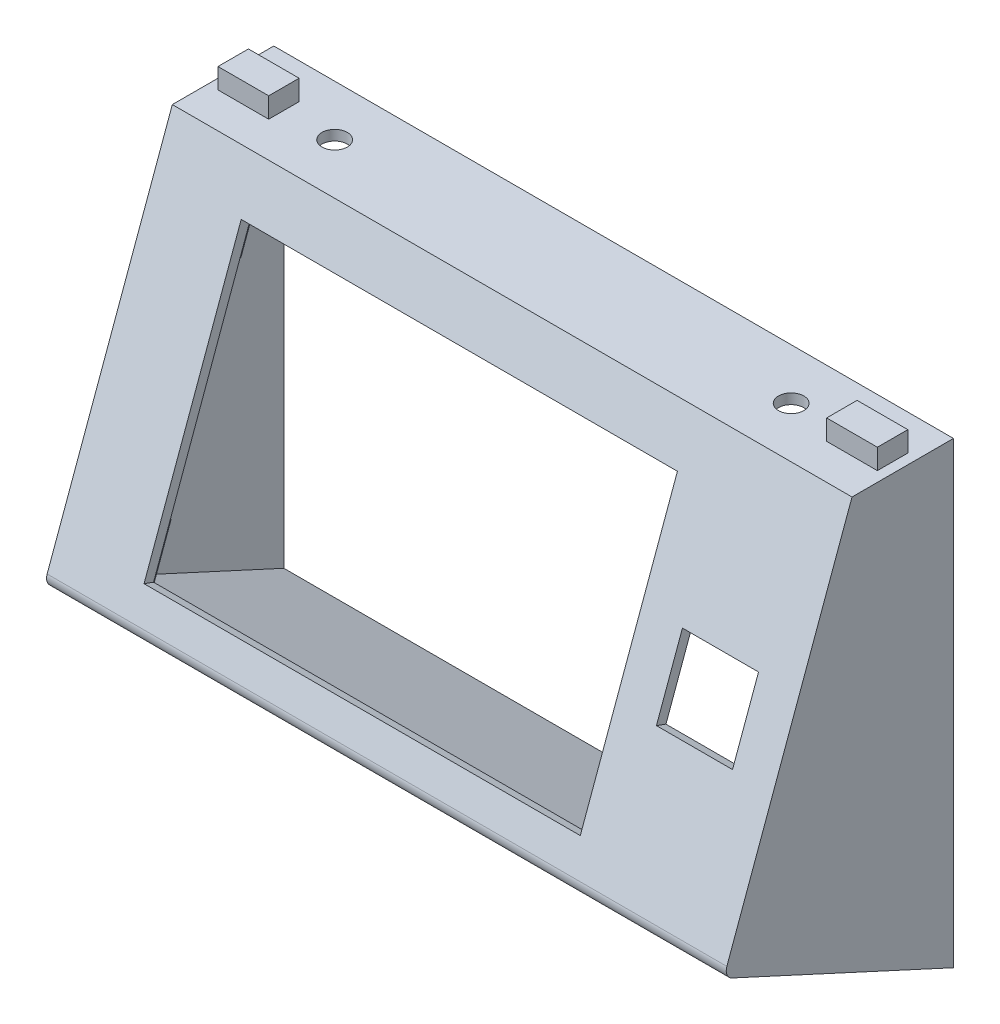
from build123d import *

# Parameters (mm, degrees)
SKETCH_1_W               = 130
SKETCH_1_H               = 20
EXTRUDE_1_DEPTH          = 2
SKETCH_2_W               = 10
SKETCH_2_H               = 6
EXTRUDE_2_DEPTH          = 4
SKETCH_3_R               = 2.5
CUT_EXTRUDE_1_DEPTH      = 4
SKETCH_4_W               = 130
SKETCH_4_H               = 74
SKETCH_4_W_2             = 86
SKETCH_4_H_2             = 56
SKETCH_4_W_3             = 15
SKETCH_4_H_3             = 15
EXTRUDE_3_DEPTH          = 2
EXTRUDE_4_DEPTH          = 2
EXTRUDE_5_DEPTH          = 2
EXTRUDE_6_DEPTH          = 130
SKETCH_9_W               = 10
SKETCH_9_H               = 18
SKETCH_9_W_2             = 12
SKETCH_9_H_2             = 15
EXTRUDE_7_DEPTH          = 4
SKETCH_10_R              = 2.25
CUT_EXTRUDE_2_DEPTH      = 5
CUT_EXTRUDE_3_DEPTH      = 118
CUT_EXTRUDE_3_DEPTH_BACK = 9
FILLET_1_R               = 2
FILLET_2_R               = 2


with BuildPart() as part:
    # Эскиз1 → Бобышка-Вытянуть1 (new body)
    with BuildSketch(Plane(origin=(0, 0, 0), x_dir=(1, 0, 0), z_dir=(0, 1, 0))):
        with Locations((65, 10)):
            Rectangle(SKETCH_1_W, SKETCH_1_H)
    extrude(amount=EXTRUDE_1_DEPTH)

    # Эскиз2 → Бобышка-Вытянуть2 (add)
    with BuildSketch(Plane(origin=(0, 2, 0), x_dir=(1, 0, 0), z_dir=(0, 1, 0))):
        with Locations((5, 10)):
            Rectangle(SKETCH_2_W, SKETCH_2_H)
        with Locations((125, 10)):
            Rectangle(SKETCH_2_W, SKETCH_2_H)
    extrude(amount=EXTRUDE_2_DEPTH)

    # Эскиз3 → Вырез-Вытянуть1 (cut)
    with BuildSketch(Plane(origin=(0, 2, 0), x_dir=(1, 0, 0), z_dir=(0, 1, 0))):
        with Locations(Location((20, 10, 0), (0, 0, 270))):
            Circle(SKETCH_3_R)
        with Locations(Location((110, 10, 0), (0, 0, 270))):
            Circle(SKETCH_3_R)
    extrude(amount=-CUT_EXTRUDE_1_DEPTH, mode=Mode.SUBTRACT)

    # Эскиз4 → Бобышка-Вытянуть3 (add)
    with BuildSketch(Plane(origin=(0, 0.233955557, 0.64278761), x_dir=(1, 0, 0), z_dir=(0, -0.3420201433256631, -0.9396926207859105))):
        with Locations((65, 35.120614758)):
            Rectangle(SKETCH_4_W, SKETCH_4_H)
        with Locations((58, 36.120614758)):
            Rectangle(SKETCH_4_W_2, SKETCH_4_H_2, mode=Mode.SUBTRACT)
        with Locations((116.5, 36.120614758)):
            Rectangle(SKETCH_4_W_3, SKETCH_4_H_3, mode=Mode.SUBTRACT)
    extrude(amount=EXTRUDE_3_DEPTH)

    # Эскиз5 → Бобышка-Вытянуть4 (add)
    with BuildSketch(Plane(origin=(130, 0, 0), x_dir=(0, 0, -1), z_dir=(1, 0, 0))):
        Polygon((0, 2), (-25.309490606, -67.537253938), (20, -88.375754865), (20, 2), align=None)
    extrude(amount=EXTRUDE_4_DEPTH)

    # Эскиз7 → Бобышка-Вытянуть5 (add)
    with BuildSketch(Plane.ZY):
        Polygon((-20, 2), (-20, -88.375754865), (25.309490606, -67.537253938), (0, 2), align=None)
    extrude(amount=EXTRUDE_5_DEPTH)

    # Эскиз8 → Бобышка-Вытянуть6 (add)
    with BuildSketch(Plane.ZY.offset(-130)):
        Polygon((-20, -86.174372086), (22.799977809, -66.490032993), (25.309490606, -67.537253938), (-20, -88.375754865), align=None)
    extrude(amount=EXTRUDE_6_DEPTH)

    # Эскиз9 → Бобышка-Вытянуть7 (add)
    with BuildSketch(Plane(origin=(0, -0.45008473, -1.236597632), x_dir=(-1, 0, 0), z_dir=(0, -0.34202014332566316, -0.9396926207859104))):
        with Locations((-125, -7.021029835)):
            Rectangle(SKETCH_9_W, SKETCH_9_H)
        with Locations((-6, -7.021029835)):
            Rectangle(SKETCH_9_W_2, SKETCH_9_H)
        with Locations((-6, -63.778245038)):
            Rectangle(SKETCH_9_W_2, SKETCH_9_H_2)
        with Locations((-125, -63.778245038)):
            Rectangle(SKETCH_9_W, SKETCH_9_H_2)
    extrude(amount=EXTRUDE_7_DEPTH)

    # Эскиз10 → Вырез-Вытянуть2 (cut)
    with BuildSketch(Plane(origin=(0, -1.818165303, -4.995368115), x_dir=(-1, 0, 0), z_dir=(0, -0.3420201433256632, -0.9396926207859104))):
        with Locations(Location((-124.5, -8.620614758, 0), (0, 0, 90))):
            Circle(SKETCH_10_R)
        with Locations(Location((-7.5, -65.620614758, 0), (0, 0, 90))):
            Circle(SKETCH_10_R)
        with Locations(Location((-124.5, -65.620614758, 0), (0, 0, 90))):
            Circle(SKETCH_10_R)
        with Locations(Location((-7.5, -8.620614758, 0), (0, 0, 90))):
            Circle(SKETCH_10_R)
    extrude(amount=-CUT_EXTRUDE_2_DEPTH, mode=Mode.SUBTRACT)

    # Эскиз11 → Вырез-Вытянуть3 (cut, two sides: drawn at the far end of the back side and taken through both)
    with BuildSketch(Plane.ZY.offset(-120).offset(-CUT_EXTRUDE_3_DEPTH_BACK)):
        Polygon((0.737210819, -5.87307888), (2.618321608, -11.041388294), (0.644967104, -11.759630595), (-1.236143684, -6.591321181), align=None)
        Polygon((20.14698757, -59.201002218), (18.173633066, -59.919244519), (20.054743854, -65.087553933), (22.028098358, -64.369311632), align=None)
    extrude(amount=CUT_EXTRUDE_3_DEPTH + CUT_EXTRUDE_3_DEPTH_BACK, mode=Mode.SUBTRACT)

    # Скругление1
    fillet_1_edges = [part.edges().sort_by_distance(p)[0] for p in [
        (66, -66.490032993, 22.799977809),
    ]]
    fillet(fillet_1_edges, radius=FILLET_1_R)

    # Скругление2
    fillet_2_edges = [part.edges().sort_by_distance(p)[0] for p in [
        (65, -67.537253938, 25.309490606),
    ]]
    fillet(fillet_2_edges, radius=FILLET_2_R)


solid = part.part
